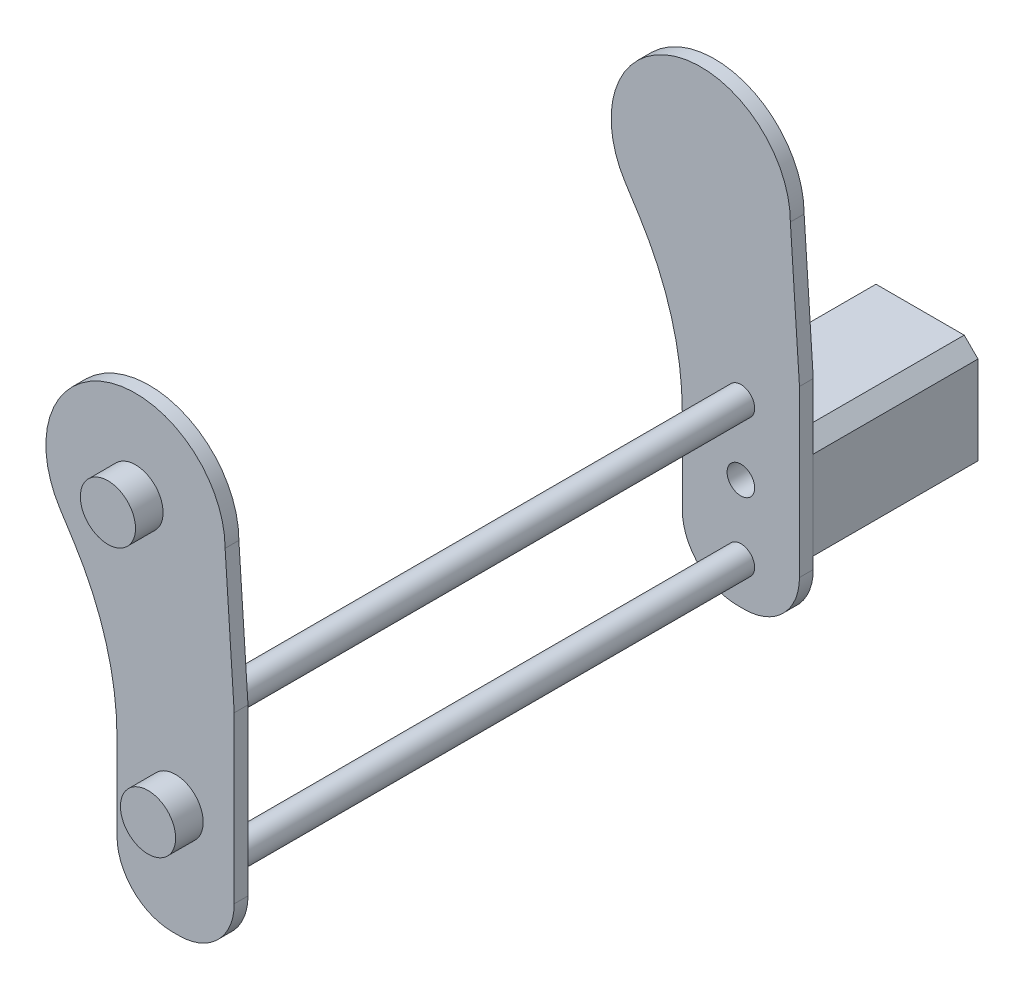
from build123d import *

# Parameters (mm, degrees)
BOSS_EXTRUDE4_DEPTH     = 5
SKETCH5_3_R             = 5
BOSS_EXTRUDE5_DEPTH     = 105
FILLET3_R               = 20
SKETCH9_R               = 10
BOSS_EXTRUDE8_DEPTH     = 10
SKETCH5_4_W             = 42
SKETCH5_4_H             = 42
BOSS_EXTRUDE6_DEPTH     = 60
CHAMFER1_SIZE           = 5
SKETCH7_R               = 10
BOSS_EXTRUDE7_DEPTH     = 10
CUT_EXTRUDE2_DEPTH      = 210
CUT_EXTRUDE2_DEPTH_BACK = 10
SKETCH8_R               = 5


with BuildPart() as part:
    # Sketch5 → Boss-Extrude4 (new body)
    with BuildSketch(Plane.XY):
        with BuildLine():
            ThreePointArc((-22.338990751, -25.429636041), (-10.689321102, -51.161900175), (-6.7, -79.125260802))
            Line((-6.7, -79.125260802), (-6.7, -130))
            Line((-6.7, -130), (35.8, -130))
            Line((35.8, -130), (35.8, -50))
            Line((35.8, -50), (32.5, 0))
            ThreePointArc((32.5, 0), (-9.088092204, 31.203470642), (-27.417328006, -17.451078047))
            Line((-27.417328006, -17.451078047), (-22.338990751, -25.429636041))
        make_face()
        with BuildLine():
            ThreePointArc((11.55, -111), (14.55, -110), (17.55, -111))
            Line((17.55, -111), (11.55, -111))
        make_face(mode=Mode.SUBTRACT)
        with BuildLine():
            ThreePointArc((17.857189139, -111.25), (14.55, -120), (11.242810861, -111.25))
            Line((11.242810861, -111.25), (17.857189139, -111.25))
        make_face(mode=Mode.SUBTRACT)
        with BuildLine():
            Line((11.55, -69), (17.55, -69))
            ThreePointArc((17.55, -69), (14.55, -70), (11.55, -69))
        make_face(mode=Mode.SUBTRACT)
        with BuildLine():
            Line((17.857189139, -68.75), (11.242810861, -68.75))
            ThreePointArc((11.242810861, -68.75), (14.55, -60), (17.857189139, -68.75))
        make_face(mode=Mode.SUBTRACT)
    extrude(amount=BOSS_EXTRUDE4_DEPTH)

    # Sketch5<3> → Boss-Extrude5 (add)
    with BuildSketch(Plane.XY):
        with Locations((14.55, -65)):
            Circle(SKETCH5_3_R)
        with Locations((14.55, -115)):
            Circle(SKETCH5_3_R)
    extrude(amount=BOSS_EXTRUDE5_DEPTH)

    # Fillet3
    fillet3_edges = [part.edges().sort_by_distance(p)[0] for p in [
        (35.8, -130, 2.5),
        (-6.7, -130, 2.5),
    ]]
    fillet(fillet3_edges, radius=FILLET3_R)

    # Sketch9 → Boss-Extrude8 (add)
    with BuildSketch(Plane(origin=(0, 0, 0), x_dir=(-1, 0, 0), z_dir=(0, 0, -1))):
        with Locations(Location((0, 0, 0), (0, 0, 180))):
            Circle(SKETCH9_R)
    extrude(amount=BOSS_EXTRUDE8_DEPTH)

    # Mirror3: part across plane


with BuildPart() as part_1:
    add(part.part)
    add(part.part.mirror(Plane(origin=(14.55, -65, 105), x_dir=(1, 0, 0), z_dir=(0, 0, 1))))

    # Sketch5<4> → Boss-Extrude6 (add)
    with BuildSketch(Plane.XY):
        with Locations((14.55, -90)):
            Rectangle(SKETCH5_4_W, SKETCH5_4_H)
    extrude(amount=-BOSS_EXTRUDE6_DEPTH)

    # Chamfer1
    chamfer1_edges = [part_1.edges().sort_by_distance(p)[0] for p in [
        (-6.45, -111, -30),
        (-6.45, -69, -30),
        (35.55, -69, -30),
        (35.55, -111, -30),
    ]]
    chamfer(chamfer1_edges, length=CHAMFER1_SIZE)

    # Sketch7 → Boss-Extrude7 (add)
    with BuildSketch(Plane.XY.offset(210)):
        with Locations(Location((14.55, -90, 0), (0, 0, 180))):
            Circle(SKETCH7_R)
    extrude(amount=BOSS_EXTRUDE7_DEPTH)

    # Sketch8 → Cut-Extrude2 (cut, two sides: drawn at the far end of the back side and taken through both)
    with BuildSketch(Plane.XY.offset(5).offset(-CUT_EXTRUDE2_DEPTH_BACK)):
        with Locations(Location((14.55, -90, 0), (0, 0, 180))):
            Circle(SKETCH8_R)
    extrude(amount=CUT_EXTRUDE2_DEPTH + CUT_EXTRUDE2_DEPTH_BACK, mode=Mode.SUBTRACT)


solid = part_1.part
